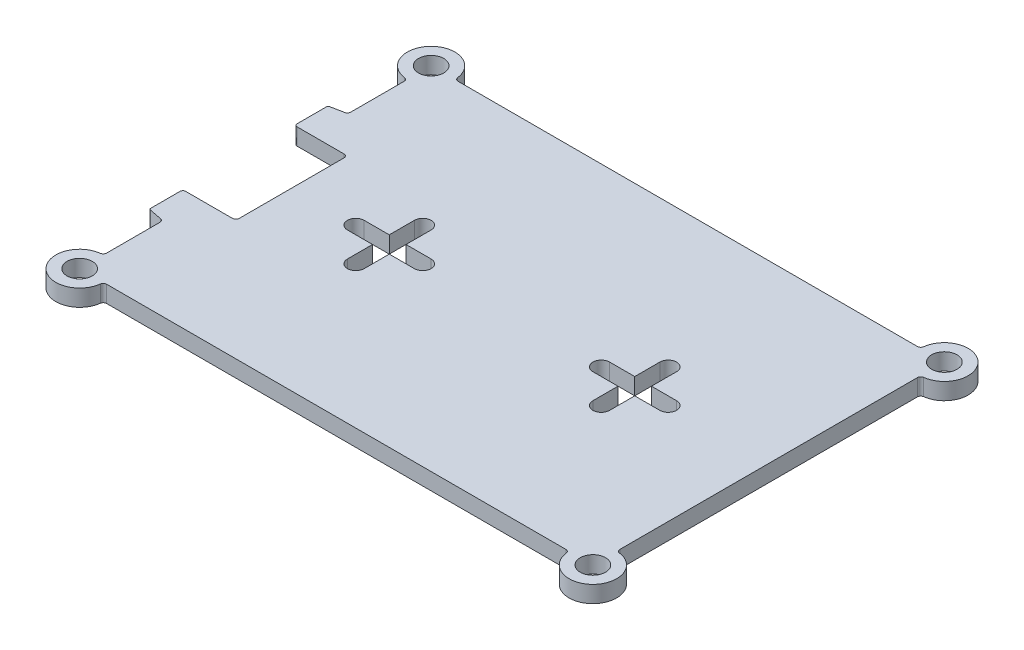
from build123d import *

# Parameters (mm, degrees)
SKETCH1_R           = 2.265
BOSS_EXTRUDE1_DEPTH = 3
CUT_EXTRUDE3_DEPTH  = 3
SKETCH8_W           = 6.5
SKETCH8_H           = 20
CUT_EXTRUDE4_DEPTH  = 3
BOSS_EXTRUDE4_DEPTH = 3
FILLET1_R           = 0.6


with BuildPart() as part:
    # Sketch1 → Boss-Extrude1 (new body)
    with BuildSketch(Plane(origin=(0, 0, 0), x_dir=(1, 0, 0), z_dir=(0, 1, 0))):
        with BuildLine():
            Line((0, -4.265), (0, -58.735))
            ThreePointArc((0, -58.735), (-3.015810422, -66.015810422), (4.265, -63))
            Line((4.265, -63), (87.735, -63))
            ThreePointArc((87.735, -63), (95.015810422, -66.015810422), (92, -58.735))
            Line((92, -58.735), (92, -4.265))
            ThreePointArc((92, -4.265), (95.015810422, 3.015810422), (87.735, 0))
            Line((87.735, 0), (4.265, 0))
            ThreePointArc((4.265, 0), (-3.015810422, 3.015810422), (0, -4.265))
        make_face()
        with Locations(Location((0, 0, 0), (0, 0, 270))):
            Circle(SKETCH1_R, mode=Mode.SUBTRACT)
        with Locations(Location((92, 0, 0), (0, 0, 270))):
            Circle(SKETCH1_R, mode=Mode.SUBTRACT)
        with Locations(Location((92, -63, 0), (0, 0, 270))):
            Circle(SKETCH1_R, mode=Mode.SUBTRACT)
        with Locations(Location((0, -63, 0), (0, 0, 270))):
            Circle(SKETCH1_R, mode=Mode.SUBTRACT)
    extrude(amount=BOSS_EXTRUDE1_DEPTH)

    # Sketch6 → Cut-Extrude3 (cut)
    with BuildSketch(Plane(origin=(0, 3, 0), x_dir=(1, 0, 0), z_dir=(0, 1, 0))):
        with BuildLine():
            Line((18, -30), (22.5, -30))
            Line((22.5, -30), (22.5, -25.5))
            ThreePointArc((22.5, -25.5), (24, -24), (25.5, -25.5))
            Line((25.5, -25.5), (25.5, -30))
            Line((25.5, -30), (30, -30))
            ThreePointArc((30, -30), (31.5, -31.5), (30, -33))
            Line((30, -33), (25.5, -33))
            Line((25.5, -33), (25.5, -37.5))
            ThreePointArc((25.5, -37.5), (24, -39), (22.5, -37.5))
            Line((22.5, -37.5), (22.5, -33))
            Line((22.5, -33), (18, -33))
            ThreePointArc((18, -33), (16.5, -31.5), (18, -30))
        make_face()
        with BuildLine():
            Line((74, -30), (69.5, -30))
            Line((69.5, -30), (69.5, -25.5))
            ThreePointArc((69.5, -25.5), (68, -24), (66.5, -25.5))
            Line((66.5, -25.5), (66.5, -30))
            Line((66.5, -30), (62, -30))
            ThreePointArc((62, -30), (60.5, -31.5), (62, -33))
            Line((62, -33), (66.5, -33))
            Line((66.5, -33), (66.5, -37.5))
            ThreePointArc((66.5, -37.5), (68, -39), (69.5, -37.5))
            Line((69.5, -37.5), (69.5, -33))
            Line((69.5, -33), (74, -33))
            ThreePointArc((74, -33), (75.5, -31.5), (74, -30))
        make_face()
    extrude(amount=-CUT_EXTRUDE3_DEPTH, mode=Mode.SUBTRACT)

    # Sketch8 → Cut-Extrude4 (cut)
    with BuildSketch(Plane(origin=(0, 3, 0), x_dir=(1, 0, 0), z_dir=(0, 1, 0))):
        with Locations((3.25, -31.5)):
            Rectangle(SKETCH8_W, SKETCH8_H)
    extrude(amount=-CUT_EXTRUDE4_DEPTH, mode=Mode.SUBTRACT)

    # Sketch9 → Boss-Extrude4 (add)
    with BuildSketch(Plane(origin=(0, 3, 0), x_dir=(1, 0, 0), z_dir=(0, 1, 0))):
        with BuildLine():
            Line((0, -21.5), (-2.5, -21.5))
            ThreePointArc((-2.5, -21.5), (-2.853553391, -21.353553391), (-3, -21))
            Line((-3, -21), (-3, -15.746058789))
            ThreePointArc((-3, -15.746058789), (-2.931958048, -15.555807734), (-2.758696908, -15.451857033))
            Line((-2.758696908, -15.451857033), (0, -14.901462701))
            Line((0, -14.901462701), (0, -21.5))
        make_face()
        with BuildLine():
            Line((0, -41.5), (0, -48.098537299))
            Line((0, -48.098537299), (-2.758696908, -47.548142967))
            ThreePointArc((-2.758696908, -47.548142967), (-2.931958048, -47.444192266), (-3, -47.253941211))
            Line((-3, -47.253941211), (-3, -42))
            ThreePointArc((-3, -42), (-2.853553391, -41.646446609), (-2.5, -41.5))
            Line((-2.5, -41.5), (0, -41.5))
        make_face()
    extrude(amount=-BOSS_EXTRUDE4_DEPTH)

    # Fillet1
    fillet1_edges = [part.edges().sort_by_distance(p)[0] for p in [
        (6.5, 1.5, 21.5),
        (6.5, 1.5, 41.5),
        (0, 1.5, 14.901462701),
        (4.265, 1.5, 0),
        (87.735, 1.5, 0),
        (92, 1.5, 4.265),
        (92, 1.5, 58.735),
        (87.735, 1.5, 63),
        (4.265, 1.5, 63),
        (0, 1.5, 58.735),
        (0, 1.5, 4.265),
        (0, 1.5, 48.098537299),
    ]]
    fillet(fillet1_edges, radius=FILLET1_R)


solid = part.part
